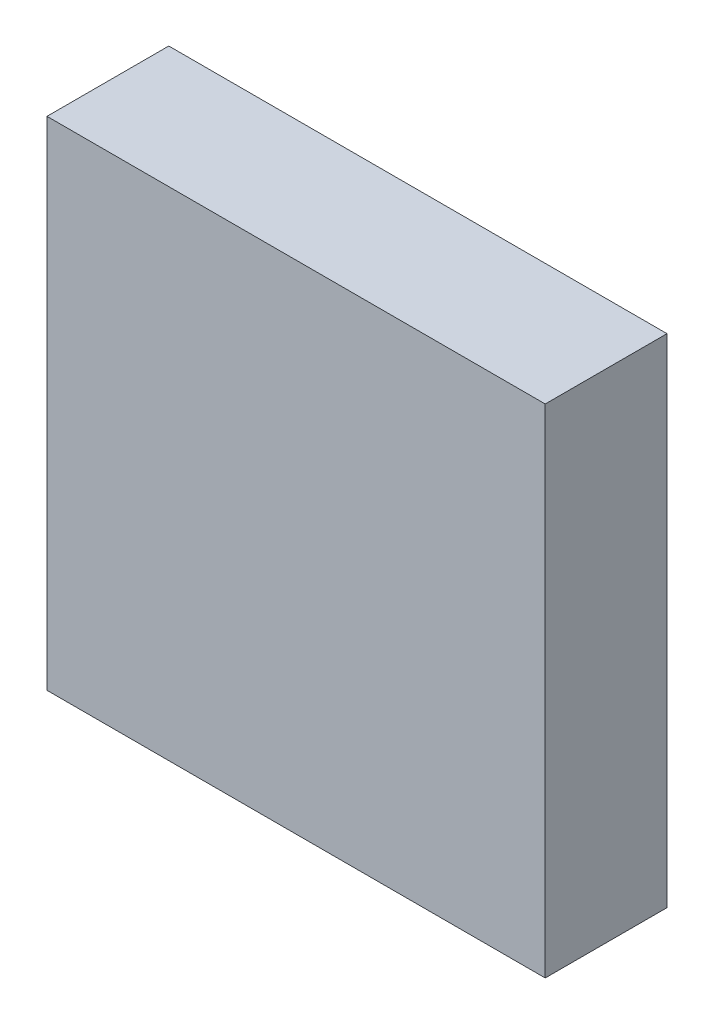
from build123d import *

# Parameters (mm, degrees)
SKIZZE1_W                       = 45
SKIZZE1_H                       = 44.9
AUFSATZ_LINEAR_AUSTRAGEN1_DEPTH = 11
SKIZZE3_R                       = 15.75
SCHNITT_LINEAR_AUSTRAGEN1_DEPTH = 10
SKIZZE7_R                       = 11.5
AUFSATZ_LINEAR_AUSTRAGEN3_DEPTH = 10
SKIZZE8_R                       = 11
SCHNITT_LINEAR_AUSTRAGEN4_DEPTH = 7


with BuildPart() as part:
    # Skizze1 → Aufsatz-Linear austragen1 (new body)
    with BuildSketch(Plane.XY):
        Rectangle(SKIZZE1_W, SKIZZE1_H)
    extrude(amount=AUFSATZ_LINEAR_AUSTRAGEN1_DEPTH)

    # Skizze3 → Schnitt-Linear austragen1 (cut)
    with BuildSketch(Plane(origin=(0, 0, 0), x_dir=(-1, 0, 0), z_dir=(0, 0, -1))):
        Circle(SKIZZE3_R)
    extrude(amount=-SCHNITT_LINEAR_AUSTRAGEN1_DEPTH, mode=Mode.SUBTRACT)

    # Skizze7 → Aufsatz-Linear austragen3 (add)
    with BuildSketch(Plane(origin=(0, 0, 0), x_dir=(-1, 0, 0), z_dir=(0, 0, -1))):
        Circle(SKIZZE7_R)
    extrude(amount=-AUFSATZ_LINEAR_AUSTRAGEN3_DEPTH)

    # Skizze8 → Schnitt-Linear austragen4 (cut)
    with BuildSketch(Plane(origin=(0, 0, 0), x_dir=(-1, 0, 0), z_dir=(0, 0, -1))):
        Circle(SKIZZE8_R)
    extrude(amount=-SCHNITT_LINEAR_AUSTRAGEN4_DEPTH, mode=Mode.SUBTRACT)


solid = part.part
